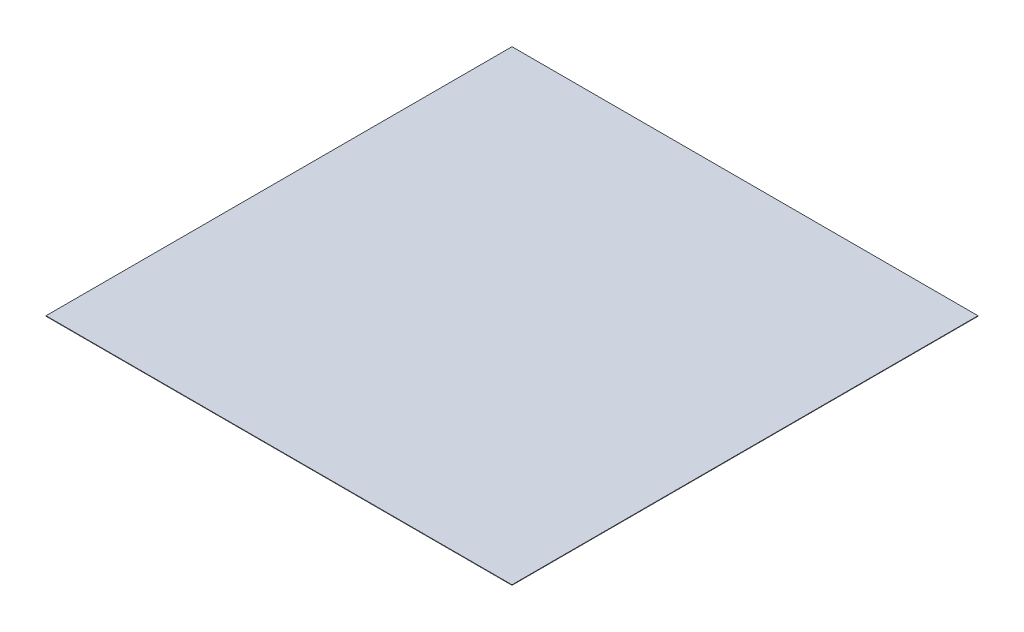
from build123d import *

# Parameters (mm, degrees)
SKETCH_1_W      = 1000
SKETCH_1_H      = 1
EXTRUDE_1_DEPTH = 1000


with BuildPart() as part:
    # Эскиз1 → Бобышка-Вытянуть1 (new body)
    with BuildSketch(Plane.XY):
        with Locations((500, 0.5)):
            Rectangle(SKETCH_1_W, SKETCH_1_H)
    extrude(amount=EXTRUDE_1_DEPTH)


solid = part.part
